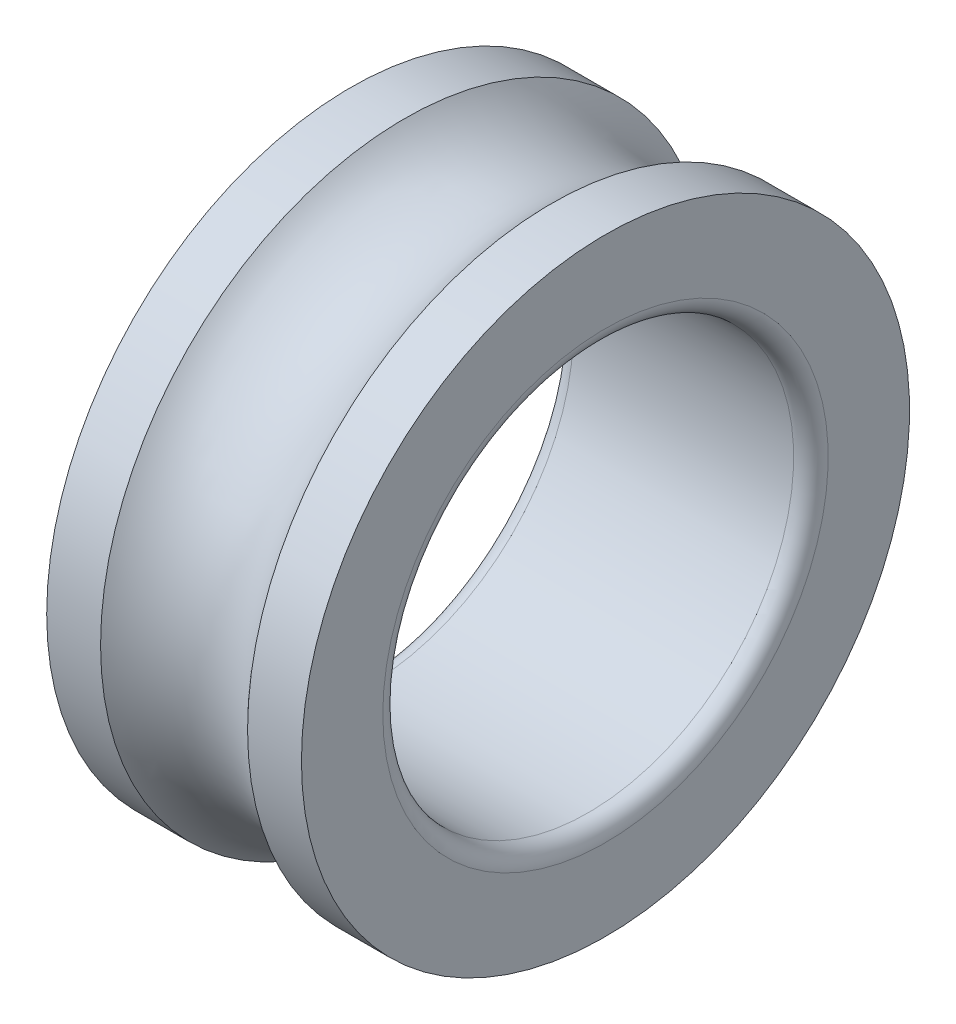
from build123d import *

# Parameters (mm, degrees)
SCALE1_SCALE = 0.2
SCALE2_SCALE = 1.9329
SCALE3_SCALE = 1.5


with BuildPart() as part:
    # Sketch1 → Revolve1 (revolve)
    with BuildSketch(Plane.XY, mode=Mode.PRIVATE) as revolve1_sk:
        with BuildLine():
            Line((-15.5, 37), (-8.94427191, 37))
            ThreePointArc((-8.94427191, 37), (0, 33), (8.94427191, 37))
            Line((8.94427191, 37), (15.5, 37))
            Line((15.5, 37), (15.5, 27.1))
            ThreePointArc((15.5, 27.1), (14.88492424, 25.61507576), (13.4, 25))
            Line((13.4, 25), (-13.4, 25))
            ThreePointArc((-13.4, 25), (-14.88492424, 25.61507576), (-15.5, 27.1))
            Line((-15.5, 27.1), (-15.5, 37))
        make_face()
    revolve(revolve1_sk.sketch.rotate(Axis((-31.142201835, 0, 0), (1, 0, 0)), 90), axis=Axis((-31.142201835, 0, 0), (1, 0, 0)))


with BuildPart() as part_1:
    # Scale1: scaled about (0, 0, 0)
    add(part.part.scale(SCALE1_SCALE))


with BuildPart() as part_2:
    # Scale2: scaled about (0, 0, 0)
    add(part_1.part.scale(SCALE2_SCALE))


with BuildPart() as part_3:
    # Scale3: scaled about (0, 0, 0)
    add(part_2.part.scale(SCALE3_SCALE))


solid = part_3.part
